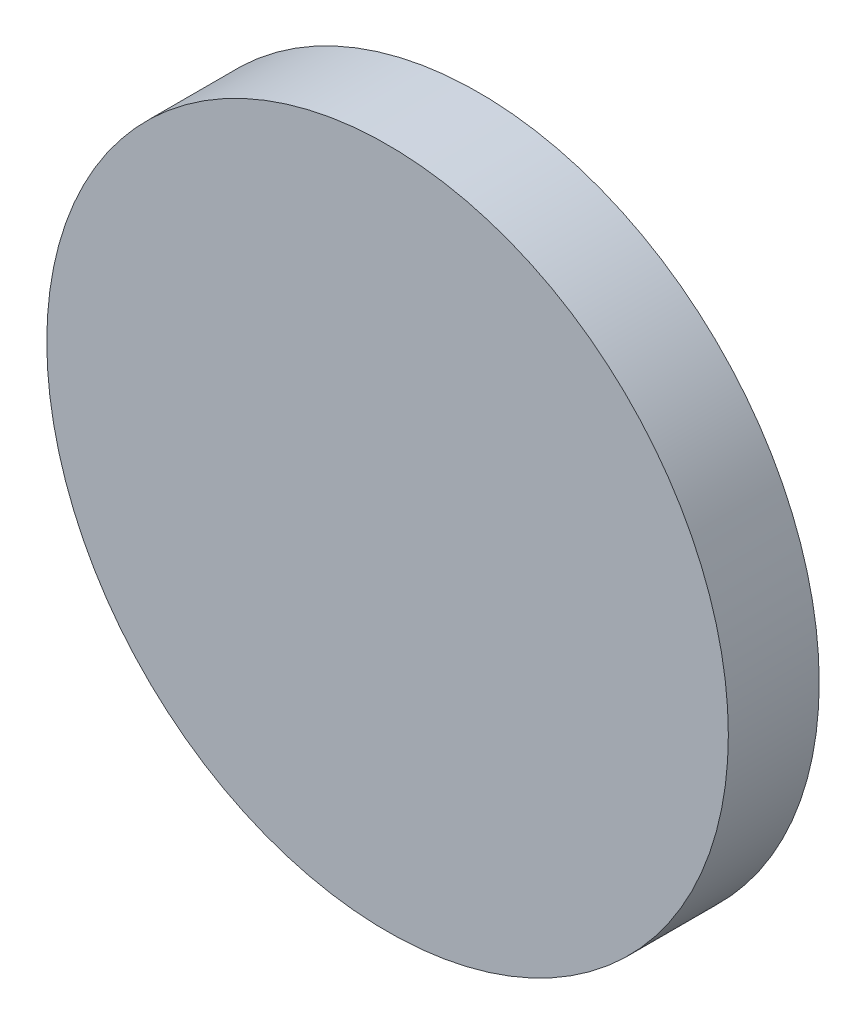
from build123d import *

# Parameters (mm, degrees)
SKETCH1_R           = 190.5
BOSS_EXTRUDE1_DEPTH = 50.8
SKETCH3_R           = 63.5
CUT_EXTRUDE2_DEPTH  = 25.4


with BuildPart() as part:
    # Sketch1 → Boss-Extrude1 (new body)
    with BuildSketch(Plane.XY):
        Circle(SKETCH1_R)
    extrude(amount=BOSS_EXTRUDE1_DEPTH)

    # Sketch3 → Cut-Extrude2 (cut)
    with BuildSketch(Plane(origin=(0, 0, 0), x_dir=(-1, 0, 0), z_dir=(0, 0, -1))):
        Circle(SKETCH3_R)
    extrude(amount=-CUT_EXTRUDE2_DEPTH, mode=Mode.SUBTRACT)


solid = part.part
